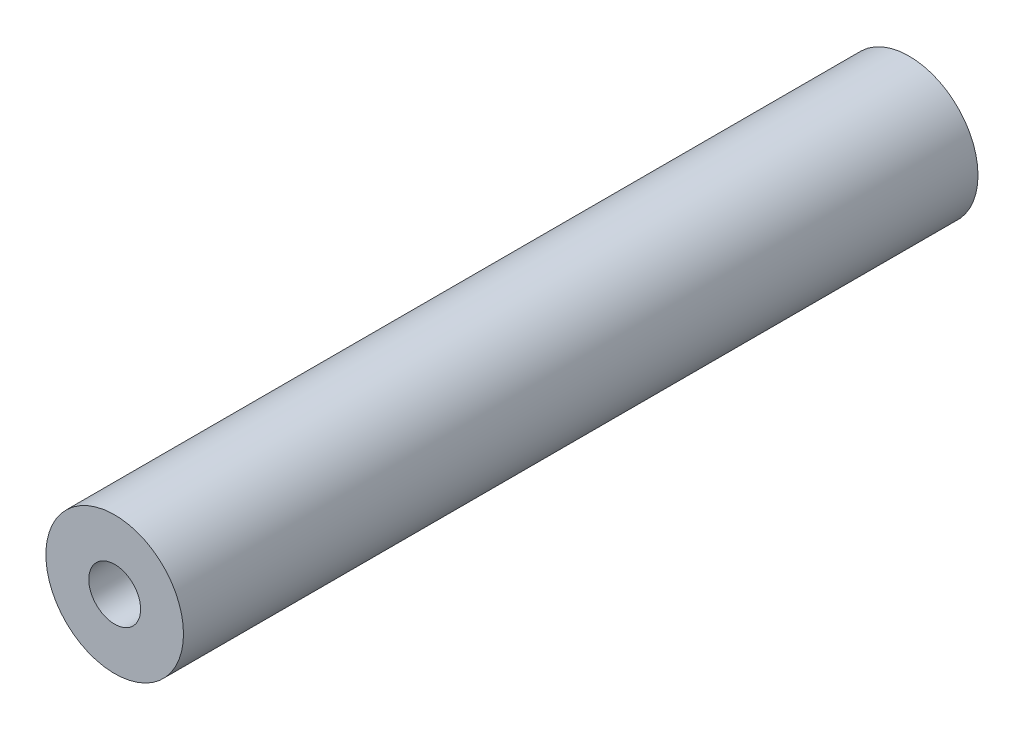
from build123d import *

# Parameters (mm, degrees)
SKETCH1_R             = 3
BOSS_EXTRUDE1_DEPTH   = 34.64
F_4_40_TAPPED_HOLE1_D = 2.2606


with BuildPart() as part:
    # Sketch1 → Boss-Extrude1 (new body)
    with BuildSketch(Plane.XY):
        Circle(SKETCH1_R)
    extrude(amount=BOSS_EXTRUDE1_DEPTH)

    # #4-40 Tapped Hole1 (through all)
    with Locations(Plane.XY.offset(34.64)):
        with Locations((0, 0)):
            Hole(F_4_40_TAPPED_HOLE1_D / 2)


solid = part.part
